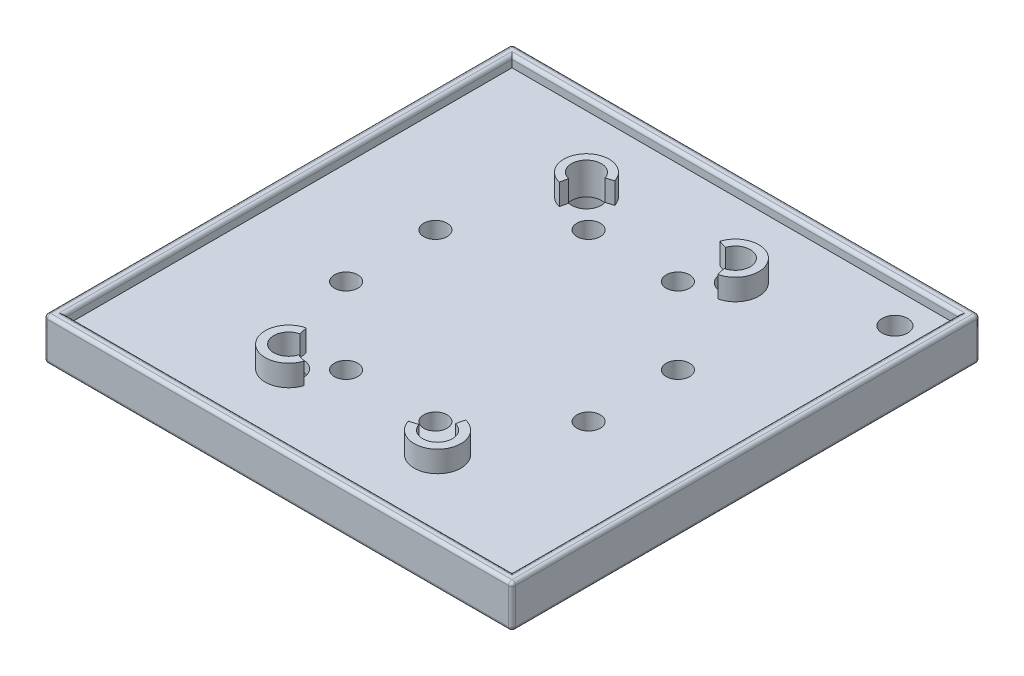
from build123d import *
from build123d.topology import SkipClean

# Parameters (mm, degrees)
SKETCH1_W               = 110
SKETCH1_H               = 110
BOSS_EXTRUDE1_DEPTH     = 10
CUT_EXTRUDE1_DEPTH      = 1
CUT_EXTRUDE1_DEPTH_BACK = 2.5
SKETCH2_W               = 105
SKETCH2_H               = 105
SKETCH5_R               = 2.75
CUT_EXTRUDE2_DEPTH      = 10
SKETCH6_R               = 3.5
CUT_EXTRUDE3_DEPTH      = 12.5
BOSS_EXTRUDE2_START     = 5
BOSS_EXTRUDE2_DEPTH     = 5
BOSS_EXTRUDE3_START     = 5
BOSS_EXTRUDE3_DEPTH     = 5
CUT_EXTRUDE5_START      = -5
SKETCH20_R              = 6
SKETCH20_R_2            = 3.5
CUT_EXTRUDE5_DEPTH      = 5
FILLET1_R               = 0.8
SKETCH23_R              = 3
CUT_EXTRUDE6_DEPTH      = 10


with BuildPart() as part:
    # Sketch1 → Boss-Extrude1 (new body)
    with BuildSketch(Plane(origin=(0, 0, 0), x_dir=(1, 0, 0), z_dir=(0, 1, 0))):
        with Locations((7.264150943, -17.018867925)):
            Rectangle(SKETCH1_W, SKETCH1_H)
    extrude(amount=BOSS_EXTRUDE1_DEPTH)

    # Sketch2 → Cut-Extrude1 (cut, two sides: drawn at the far end of the back side and taken through both)
    with BuildSketch(Plane(origin=(0, 10, 0), x_dir=(1, 0, 0), z_dir=(0, 1, 0)).offset(-CUT_EXTRUDE1_DEPTH_BACK)):
        with Locations((7.264150943, -17.018867925)):
            Rectangle(SKETCH2_W, SKETCH2_H)
    extrude(amount=CUT_EXTRUDE1_DEPTH + CUT_EXTRUDE1_DEPTH_BACK, mode=Mode.SUBTRACT)

    # Sketch5 → Cut-Extrude2 (cut)
    with BuildSketch(Plane(origin=(0, 7.5, 0), x_dir=(1, 0, 0), z_dir=(0, 1, 0))):
        with Locations(Location((-3.235849057, 11.481132075, 0), (0, 0, 270))):
            Circle(SKETCH5_R)
        with Locations(Location((17.764150943, 11.481132075, 0), (0, 0, 270))):
            Circle(SKETCH5_R)
        with Locations(Location((-3.235849057, -45.518867925, 0), (0, 0, 270))):
            Circle(SKETCH5_R)
        with Locations(Location((17.764150943, -45.518867925, 0), (0, 0, 270))):
            Circle(SKETCH5_R)
        with Locations(Location((-21.235849057, -6.518867925, 0), (0, 0, 270))):
            Circle(SKETCH5_R)
        with Locations(Location((-21.235849057, -27.518867925, 0), (0, 0, 270))):
            Circle(SKETCH5_R)
        with Locations(Location((35.764150943, -6.518867925, 0), (0, 0, 270))):
            Circle(SKETCH5_R)
        with Locations(Location((35.764150943, -27.518867925, 0), (0, 0, 270))):
            Circle(SKETCH5_R)
    extrude(amount=-CUT_EXTRUDE2_DEPTH, mode=Mode.SUBTRACT)

    # Sketch6 → Cut-Extrude3 (cut)
    with BuildSketch(Plane(origin=(0, 7.5, 0), x_dir=(1, 0, 0), z_dir=(0, 1, 0))):
        with Locations(Location((-10.235849057, 17.981132075, 0), (0, 0, 270))):
            Circle(SKETCH6_R)
        with Locations(Location((24.764150943, 17.981132075, 0), (0, 0, 270))):
            Circle(SKETCH6_R)
        with Locations(Location((-10.235849057, -52.018867925, 0), (0, 0, 270))):
            Circle(SKETCH6_R)
        with Locations(Location((24.764150943, -52.018867925, 0), (0, 0, 270))):
            Circle(SKETCH6_R)
    extrude(amount=-CUT_EXTRUDE3_DEPTH, mode=Mode.SUBTRACT)

    # Sketch8 → Boss-Extrude2 (add)
    with SkipClean():  # the faces are left unmerged after this step: merging them gives an invalid solid
        with BuildSketch(Plane(origin=(0, 7.5, 0), x_dir=(1, 0, 0), z_dir=(0, 1, 0)).offset(BOSS_EXTRUDE2_START)):
            with BuildLine():
                Line((19.507777717, 19.600322443), (21.41925455, 19.01150488))
                ThreePointArc((21.41925455, 19.01150488), (27.328928164, 20.362710923), (25.544270116, 14.569180423))
                Line((25.544270116, 14.569180423), (25.990077565, 12.619384146))
                ThreePointArc((25.990077565, 12.619384146), (28.794597548, 21.723689637), (19.507777717, 19.600322443))
            make_face()
        extrude(amount=-BOSS_EXTRUDE2_DEPTH)

    # Sketch15 → Boss-Extrude3 (add)
    with SkipClean():  # the faces are left unmerged after this step: merging them gives an invalid solid
        with BuildSketch(Plane(origin=(0, 7.5, 0), x_dir=(1, 0, 0), z_dir=(0, 1, 0)).offset(BOSS_EXTRUDE3_START)):
            with BuildLine():
                Line((-11.422433018, 12.791454335), (-11.01596823, 14.569180423))
                ThreePointArc((-11.01596823, 14.569180423), (-12.800626277, 20.362710923), (-6.890952663, 19.01150488))
                Line((-6.890952663, 19.01150488), (-5.148164315, 19.548359092))
                ThreePointArc((-5.148164315, 19.548359092), (-14.136949837, 21.6035828), (-11.422433018, 12.791454335))
            make_face()
            with BuildLine():
                Line((-11.461750614, -46.657229614), (-11.01596823, -48.606916272))
                ThreePointArc((-11.01596823, -48.606916272), (-12.800626277, -54.400446772), (-6.890952663, -53.049240729))
                Line((-6.890952663, -53.049240729), (-4.979583295, -53.638025188))
                ThreePointArc((-4.979583295, -53.638025188), (-14.266213261, -55.761348971), (-11.461750614, -46.657229614))
            make_face()
            with BuildLine():
                Line((19.507885182, -53.638025188), (21.41925455, -53.049240729))
                ThreePointArc((21.41925455, -53.049240729), (27.328928164, -54.400446772), (25.544270116, -48.606916272))
                Line((25.544270116, -48.606916272), (25.990052501, -46.657229614))
                ThreePointArc((25.990052501, -46.657229614), (28.794515147, -55.761348971), (19.507885182, -53.638025188))
            make_face()
        extrude(amount=-BOSS_EXTRUDE3_DEPTH)

    # Sketch20 → Cut-Extrude5 (cut)
    # profile 1 of 4: a face of its own
    with SkipClean():  # the faces are left unmerged after this step: merging them gives an invalid solid
        with BuildSketch(Plane.XZ.offset(CUT_EXTRUDE5_START)):
            with Locations(Location((-10.235849057, 52.018867925, 0), (0, 0, 270))):
                Circle(SKETCH20_R)
            with Locations(Location((-10.235849057, 52.018867925, 0), (0, 0, 17.121096397))):
                Circle(SKETCH20_R_2, mode=Mode.SUBTRACT)
        # profile 2 of 4: a face of its own
        with BuildSketch(Plane.XZ.offset(CUT_EXTRUDE5_START)):
            with Locations(Location((-10.235849057, -17.981132075, 0), (0, 0, 270))):
                Circle(SKETCH20_R)
            with Locations(Location((-10.235849057, -17.981132075, 0), (0, 0, 102.878903603))):
                Circle(SKETCH20_R_2, mode=Mode.SUBTRACT)
        # profile 3 of 4: a face of its own
        with BuildSketch(Plane.XZ.offset(CUT_EXTRUDE5_START)):
            with Locations(Location((24.764150943, -17.981132075, 0), (0, 0, 270))):
                Circle(SKETCH20_R)
            with Locations(Location((24.764150943, -17.981132075, 0), (0, 0, 77.121096397))):
                Circle(SKETCH20_R_2, mode=Mode.SUBTRACT)
        # profile 4 of 4: a face of its own
        with BuildSketch(Plane.XZ.offset(CUT_EXTRUDE5_START)):
            with Locations(Location((24.764150943, 52.018867925, 0), (0, 0, 270))):
                Circle(SKETCH20_R)
            with Locations(Location((24.764150943, 52.018867925, 0), (0, 0, 162.878903603))):
                Circle(SKETCH20_R_2, mode=Mode.SUBTRACT)
        extrude(amount=CUT_EXTRUDE5_DEPTH, mode=Mode.SUBTRACT)

    # Fillet1
    fillet1_edges = [part.edges().sort_by_distance(p)[0] for p in [
        (62.264150943, 10, 17.018867925),
        (7.264150943, 10, -35.481132075),
        (59.764150943, 10, 17.018867925),
        (7.264150943, 10, 69.518867925),
        (-45.235849057, 10, 17.018867925),
        (7.264150943, 10, -37.981132075),
        (-47.735849057, 10, 17.018867925),
        (7.264150943, 0, -37.981132075),
        (62.264150943, 0, 17.018867925),
        (7.264150943, 0, 72.018867925),
        (-47.735849057, 0, 17.018867925),
        (-47.735849057, 5, -37.981132075),
        (62.264150943, 5, -37.981132075),
        (62.264150943, 5, 72.018867925),
        (-47.735849057, 5, 72.018867925),
        (7.264150943, 10, 72.018867925),
    ]]
    fillet(fillet1_edges, radius=FILLET1_R)

    # Sketch23 → Cut-Extrude6 (cut)
    with SkipClean():  # the faces are left unmerged after this step: merging them gives an invalid solid
        with BuildSketch(Plane(origin=(0, 7.5, 0), x_dir=(1, 0, 0), z_dir=(0, 1, 0))):
            with Locations(Location((52.264150943, 27.981132075, 0), (0, 0, 270))):
                Circle(SKETCH23_R)
        extrude(amount=-CUT_EXTRUDE6_DEPTH, mode=Mode.SUBTRACT)


solid = part.part
